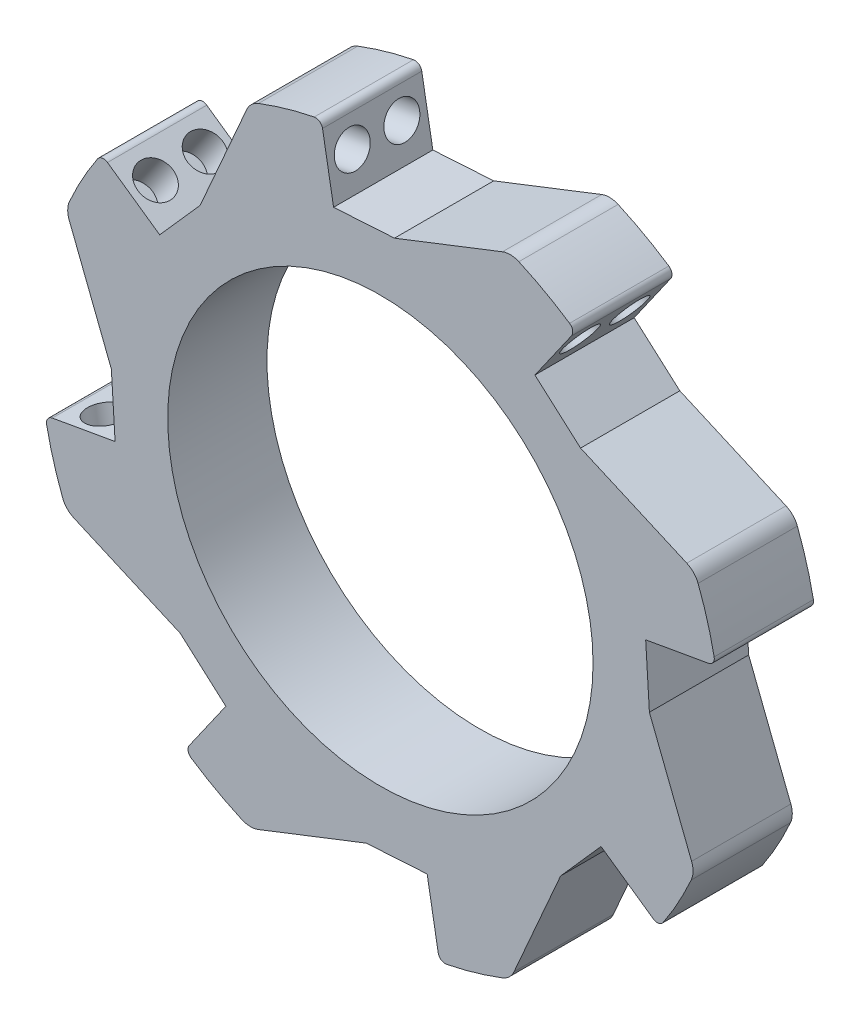
from build123d import *

# Parameters (mm, degrees)
SKETCH1_R           = 35
SKETCH1_R_2         = 30
BOSS_EXTRUDE2_DEPTH = 14
FILLET1_R           = 3
FILLET2_R           = 3
FILLET3_R           = 1
SKETCH2_R           = 2.5
CUT_EXTRUDE1_DEPTH  = 5
CIRPATTERN3_COUNT   = 8


with BuildPart() as part:
    # Sketch1 → Boss-Extrude2 (new body)
    # profile 1 of 2: a face of its own
    with BuildSketch(Plane.XY):
        with BuildLine():
            Line((-6.598630751, 37.422694614), (-8.335112528, 47.270772145))
            ThreePointArc((-8.335112528, 47.270772145), (-13.431792673, 46.082393011), (-18.368804754, 44.346217561))
            Line((-18.368804754, 44.346217561), (-25.426963042, 28.239503368))
            Line((-25.426963042, 28.239503368), (-31.127777683, 21.795904581))
            Line((-31.127777683, 21.795904581), (-39.319298126, 27.531668945))
            ThreePointArc((-39.319298126, 27.531668945), (-42.082884274, 23.087460908), (-44.346217561, 18.368804754))
            Line((-44.346217561, 18.368804754), (-37.947922321, 1.988766337))
            Line((-37.947922321, 1.988766337), (-37.422694614, -6.598630751))
            Line((-37.422694614, -6.598630751), (-47.270772145, -8.335112528))
            ThreePointArc((-47.270772145, -8.335112528), (-46.082393011, -13.431792673), (-44.346217561, -18.368804754))
            Line((-44.346217561, -18.368804754), (-28.239503368, -25.426963042))
            Line((-28.239503368, -25.426963042), (-21.795904581, -31.127777683))
            Line((-21.795904581, -31.127777683), (-27.531668945, -39.319298126))
            ThreePointArc((-27.531668945, -39.319298126), (-23.087460908, -42.082884274), (-18.368804754, -44.346217561))
            Line((-18.368804754, -44.346217561), (-1.988766337, -37.947922321))
            Line((-1.988766337, -37.947922321), (6.598630751, -37.422694614))
            Line((6.598630751, -37.422694614), (8.335112528, -47.270772145))
            ThreePointArc((8.335112528, -47.270772145), (13.431792673, -46.082393011), (18.368804754, -44.346217561))
            Line((18.368804754, -44.346217561), (25.426963042, -28.239503368))
            Line((25.426963042, -28.239503368), (31.127777683, -21.795904581))
            Line((31.127777683, -21.795904581), (39.319298126, -27.531668945))
            ThreePointArc((39.319298126, -27.531668945), (42.082884274, -23.087460908), (44.346217561, -18.368804754))
            Line((44.346217561, -18.368804754), (37.947922321, -1.988766337))
            Line((37.947922321, -1.988766337), (37.422694614, 6.598630751))
            Line((37.422694614, 6.598630751), (47.270772145, 8.335112528))
            ThreePointArc((47.270772145, 8.335112528), (46.082393011, 13.431792673), (44.346217561, 18.368804754))
            Line((44.346217561, 18.368804754), (28.239503368, 25.426963042))
            Line((28.239503368, 25.426963042), (21.795904581, 31.127777683))
            Line((21.795904581, 31.127777683), (27.531668945, 39.319298126))
            ThreePointArc((27.531668945, 39.319298126), (23.087460908, 42.082884274), (18.368804754, 44.346217561))
            Line((18.368804754, 44.346217561), (1.988766337, 37.947922321))
            Line((1.988766337, 37.947922321), (-6.598630751, 37.422694614))
        make_face()
        Circle(SKETCH1_R, mode=Mode.SUBTRACT)
    # profile 2 of 2: a face of its own
    with BuildSketch(Plane.XY):
        Circle(SKETCH1_R)
        Circle(SKETCH1_R_2, mode=Mode.SUBTRACT)
    extrude(amount=BOSS_EXTRUDE2_DEPTH)

    # Fillet1
    fillet1_edges = [part.edges().sort_by_distance(p)[0] for p in [
        (-18.368804754, 44.346217561, 7),
    ]]
    fillet(fillet1_edges, radius=FILLET1_R)

    # Fillet2
    fillet2_edges = [part.edges().sort_by_distance(p)[0] for p in [
        (44.346217561, -18.368804754, 7),
        (18.368804754, -44.346217561, 7),
        (-18.368804754, -44.346217561, 7),
        (-44.346217561, -18.368804754, 7),
        (-44.346217561, 18.368804754, 7),
        (18.368804754, 44.346217561, 7),
        (44.346217561, 18.368804754, 7),
    ]]
    fillet(fillet2_edges, radius=FILLET2_R)

    # Fillet3
    fillet3_edges = [part.edges().sort_by_distance(p)[0] for p in [
        (39.319298126, -27.531668945, 7),
        (8.335112528, -47.270772145, 7),
        (-27.531668945, -39.319298126, 7),
        (-47.270772145, -8.335112528, 7),
        (-39.319298126, 27.531668945, 7),
        (-8.335112528, 47.270772145, 7),
        (27.531668945, 39.319298126, 7),
        (47.270772145, 8.335112528, 7),
    ]]
    fillet(fillet3_edges, radius=FILLET3_R)

    # Sketch2 → Cut-Extrude1 (cut)
    with BuildSketch(Plane(origin=(0, 0, 0), x_dir=(0, 0, -1), z_dir=(0.8191520442889921, -0.5735764363510456, 0))):
        with Locations(Location((-3.5, 43, 0), (0, 0, 90))):
            Circle(SKETCH2_R)
        with Locations(Location((-10.5, 43, 0), (0, 0, 90))):
            Circle(SKETCH2_R)
    cut_extrude1 = extrude(amount=-CUT_EXTRUDE1_DEPTH, mode=Mode.SUBTRACT)

    # CirPattern3: Cut-Extrude1 ×8 about axis
    cirpattern3_axis = Axis((0, 0, 0), (0, 0, 1))
    for i in range(1, CIRPATTERN3_COUNT):
        add(cut_extrude1.rotate(cirpattern3_axis, i * 360 / CIRPATTERN3_COUNT), mode=Mode.SUBTRACT)


solid = part.part
